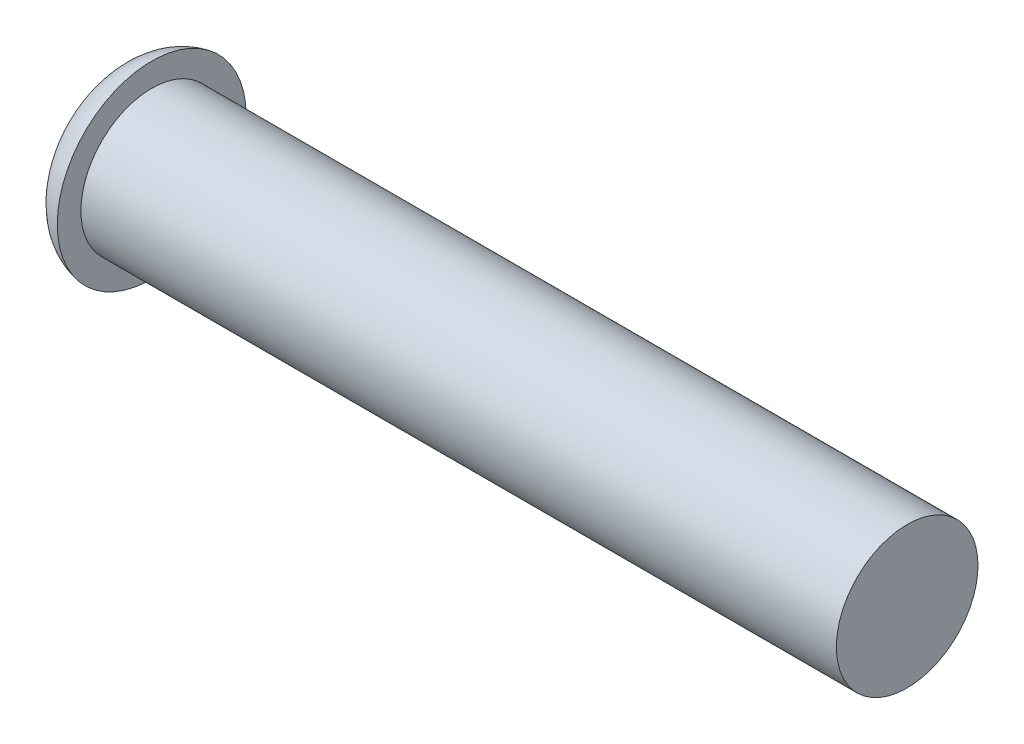
from build123d import *

# Parameters (mm, degrees)
SKETCH3_R          = 0.593950471
CUT_EXTRUDE1_DEPTH = 1.5
SKETCH4_R          = 0.593950471
CUT_EXTRUDE2_DEPTH = 1.5


with BuildPart() as part:
    # Sketch1 → Revolve1 (revolve)
    with BuildSketch(Plane(origin=(0, 0, 0), x_dir=(1, 0, 0), z_dir=(0, 1, 0)), mode=Mode.PRIVATE) as revolve1_sk:
        with BuildLine():
            add(Edge.make_bspline(
                [(-16, -0.5), (-16.59076322, -0.390621653), (-16.887881425, 0.197649901), (-16.95, 0.906049529)],
                knots=[0, 0, 0, 0, 0.787142654, 0.787142654, 0.787142654, 0.787142654], degree=3))
            Line((-16.95, 0.906049529), (-16.95, 1.5))
            Line((-16.95, 1.5), (0, 1.5))
            Line((0, 1.5), (0, 0))
            Line((0, 0), (-16, 0))
            Line((-16, 0), (-16, -0.5))
        make_face()
    revolve(revolve1_sk.sketch.rotate(Axis((0, 0, -1.5), (-1, 0, 0)), 180), axis=Axis((0, 0, -1.5), (-1, 0, 0)))

    # Sketch3 → Cut-Extrude1 (cut)
    with BuildSketch(Plane.ZY.offset(16.95)):
        Polygon((-0.924807923, 1.001242932), (-2.079505776, 0.998752416), (-2.654697853, -0.002490515), (-2.075192077, -1.001242932), (-0.920494224, -0.998752416), (-0.345302147, 0.002490515), align=None)
        with Locations((-1.5, 0)):
            Circle(SKETCH3_R, mode=Mode.SUBTRACT)
    extrude(amount=-CUT_EXTRUDE1_DEPTH, mode=Mode.SUBTRACT)

    # Sketch4 → Cut-Extrude2 (cut)
    with BuildSketch(Plane.ZY.offset(16.95)):
        with Locations((-1.5, 0)):
            Circle(SKETCH4_R)
    extrude(amount=-CUT_EXTRUDE2_DEPTH, mode=Mode.SUBTRACT)


solid = part.part
